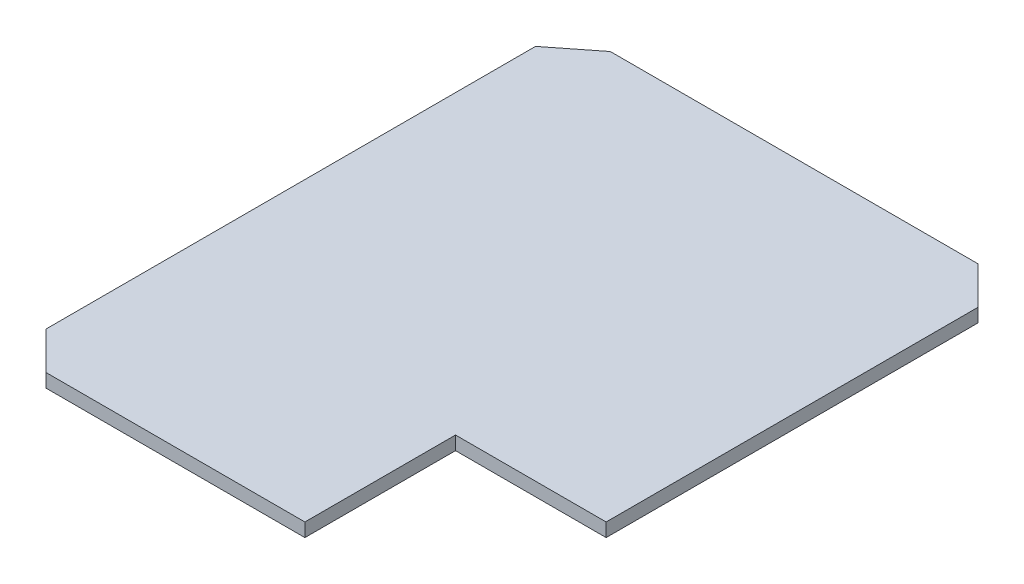
from build123d import *

# Parameters (mm, degrees)
BOSS_EXTRUDE1_DEPTH = 18.288


with BuildPart() as part:
    # Sketch1 → Boss-Extrude1 (new body)
    with BuildSketch(Plane(origin=(0, 0, 0), x_dir=(1, 0, 0), z_dir=(0, 1, 0))):
        Polygon((-197.55996545, 183.857828321), (-254, 139.407828321), (-254, -520.992171679), (-203.2, -571.792171679), (146.05, -571.792171679), (146.05, -368.592171679), (349.25, -368.592171679), (349.25, 133.057828321), (298.45, 183.857828321), align=None)
    extrude(amount=BOSS_EXTRUDE1_DEPTH)


solid = part.part
